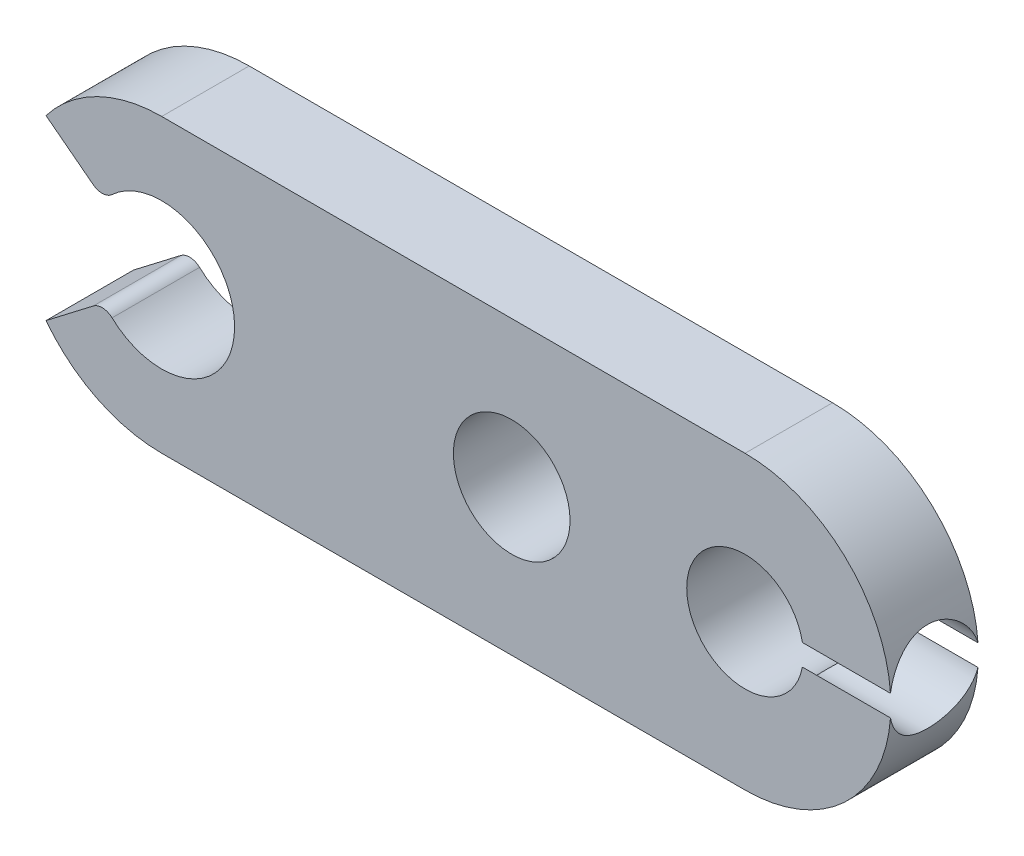
from build123d import *

# Parameters (mm, degrees)
BOSS_EXTRUDE1_DEPTH = 3
FILLET1_R           = 0.5
SKETCH2_R           = 2
CUT_EXTRUDE1_DEPTH  = 10
SKETCH3_R           = 2
CUT_EXTRUDE2_DEPTH  = 3
CUT_EXTRUDE3_START  = 50
SKETCH4_R           = 1.54375
CUT_EXTRUDE3_DEPTH  = 30
CUT_EXTRUDE4_START  = -1.5
CUT_EXTRUDE4_DEPTH  = 0.5


with BuildPart() as part:
    # Sketch1 → Boss-Extrude1 (new body)
    with BuildSketch(Plane.XY):
        with BuildLine():
            Line((-3.966766701, 3.043807145), (-1.983383351, 1.521903573))
            ThreePointArc((-1.983383351, 1.521903573), (2.5, 0), (-1.983383351, -1.521903573))
            Line((-1.983383351, -1.521903573), (-3.966766701, -3.043807145))
            ThreePointArc((-3.966766701, -3.043807145), (-2.211443451, -4.484363708), (0, -5))
            Line((0, -5), (20, -5))
            ThreePointArc((20, -5), (25, 0), (20, 5))
            Line((20, 5), (0, 5))
            ThreePointArc((0, 5), (-2.211443451, 4.484363708), (-3.966766701, 3.043807145))
        make_face()
    extrude(amount=BOSS_EXTRUDE1_DEPTH)

    # Fillet1
    fillet1_edges = [part.edges().sort_by_distance(p)[0] for p in [
        (-1.983383351, -1.521903573, 1.5),
        (-1.983383351, 1.521903573, 1.5),
    ]]
    fillet(fillet1_edges, radius=FILLET1_R)

    # Sketch2 → Cut-Extrude1 (cut)
    with BuildSketch(Plane.XY.offset(3)):
        with Locations((20, 0)):
            Circle(SKETCH2_R)
    extrude(amount=-CUT_EXTRUDE1_DEPTH, mode=Mode.SUBTRACT)

    # Sketch3 → Cut-Extrude2 (cut)
    with BuildSketch(Plane.XY.offset(3)):
        with Locations((12, 0)):
            Circle(SKETCH3_R)
    extrude(amount=-CUT_EXTRUDE2_DEPTH, mode=Mode.SUBTRACT)

    # Sketch4 → Cut-Extrude3 (cut)
    with BuildSketch(Plane(origin=(0, 0, 0), x_dir=(0, 0, -1), z_dir=(1, 0, 0)).offset(CUT_EXTRUDE3_START)):
        with Locations((-1.5, 0)):
            Circle(SKETCH4_R)
    extrude(amount=-CUT_EXTRUDE3_DEPTH, mode=Mode.SUBTRACT)

    # Sketch5 → Cut-Extrude4 (cut, symmetric)
    with BuildSketch(Plane(origin=(0, 0, 0), x_dir=(-1, 0, 0), z_dir=(0, 0, -1)).offset(CUT_EXTRUDE4_START)):
        with BuildLine():
            Line((-21.608635668, -3.66227952), (-23.404072372, -3.66227952))
            ThreePointArc((-23.404072372, -3.66227952), (-21.828743065, -4.653568394), (-20, -5))
            Line((-20, -5), (0, -5))
            Line((0, -5), (3, -5))
            Line((3, -5), (3, -4))
            Line((3, -4), (-20, -4))
            ThreePointArc((-20, -4), (-20.821852152, -3.914659505), (-21.608635668, -3.66227952))
        make_face()
    extrude(amount=CUT_EXTRUDE4_DEPTH, both=True, mode=Mode.SUBTRACT)


solid = part.part
